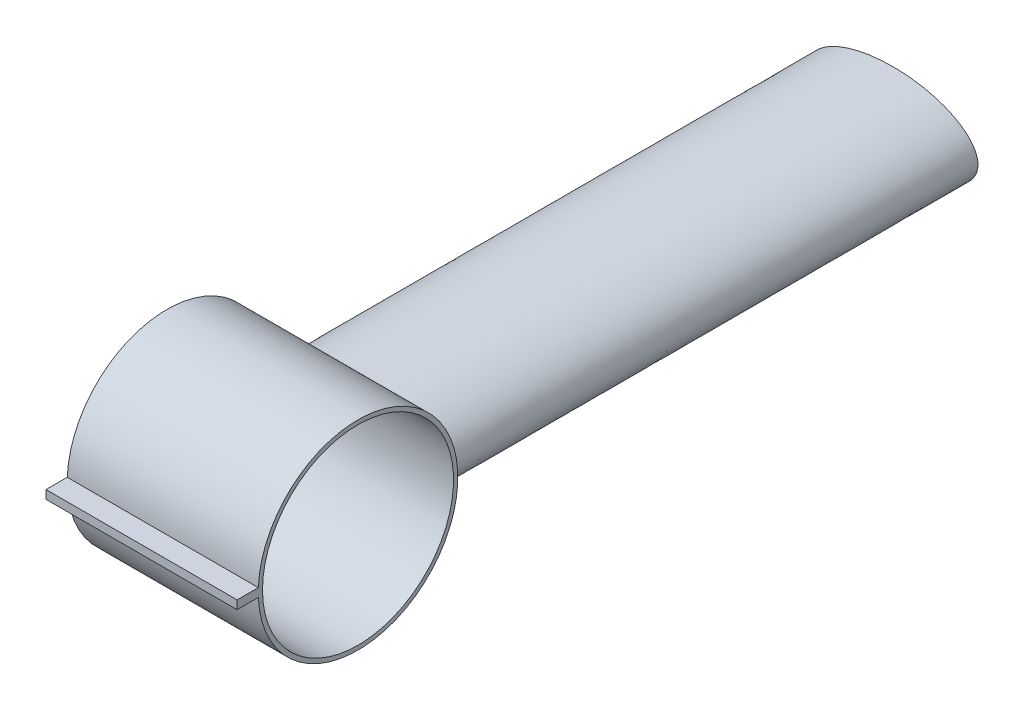
from build123d import *

# Parameters (mm, degrees)
CLASP_SKETCH_R                  = 45
CLASP_EXTRUDE_DEPTH             = 90
SHAFT_EXTRUDE_REACH             = 147.314
SHAFT_EXTRUDE_END_RADIUS        = 47
SHAFT_SKETCH_RX                 = 40
SHAFT_SKETCH_RY                 = 20
SHAFT_EXTRUDE_DIRECTION_2_DEPTH = 250


with BuildPart() as part:
    # Clasp Sketch → Clasp Extrude (new body)
    with BuildSketch(Plane(origin=(0, 0, 0), x_dir=(0, 0, -1), z_dir=(1, 0, 0))):
        with BuildLine():
            Line((-56.957427527, -2), (-56.957427527, 2))
            Line((-56.957427527, 2), (-46.957427527, 2))
            ThreePointArc((-46.957427527, 2), (47, 0), (-46.957427527, -2))
            Line((-46.957427527, -2), (-56.957427527, -2))
        make_face()
        Circle(CLASP_SKETCH_R, mode=Mode.SUBTRACT)
    extrude(amount=CLASP_EXTRUDE_DEPTH)

    # Shaft Extrude: up to this cylinder (the profile starts outside it)
    shaft_extrude_end = Plane(origin=(45, 0, 0), z_dir=(-1, 0, 0)) * Cylinder(SHAFT_EXTRUDE_END_RADIUS, 389.628, mode=Mode.PRIVATE)
    # Shaft Sketch → Shaft Extrude (add, up to the surface)
    with BuildSketch(Plane(origin=(0, 0, -47), x_dir=(-1, 0, 0), z_dir=(0, 0, -1)), mode=Mode.PRIVATE) as shaft_extrude_sk1:
        with Locations(Location((-45, 0), (0, 0, 0))):
            Ellipse(SHAFT_SKETCH_RX, SHAFT_SKETCH_RY)
    shaft_extrude_tool1 = extrude(shaft_extrude_sk1.sketch, amount=-SHAFT_EXTRUDE_REACH, mode=Mode.PRIVATE) - shaft_extrude_end
    add(shaft_extrude_tool1.solids().sort_by_distance((45, 0, -47))[0])
    add(shaft_extrude_tool1.solids().sort_by_distance((45, 0, -47))[1])

    # Shaft Sketch → Shaft Extrude direction 2 (add)
    with BuildSketch(Plane(origin=(0, 0, -47), x_dir=(-1, 0, 0), z_dir=(0, 0, -1))):
        with Locations(Location((-45, 0), (0, 0, 0))):
            Ellipse(SHAFT_SKETCH_RX, SHAFT_SKETCH_RY)
    extrude(amount=SHAFT_EXTRUDE_DIRECTION_2_DEPTH)


solid = part.part
